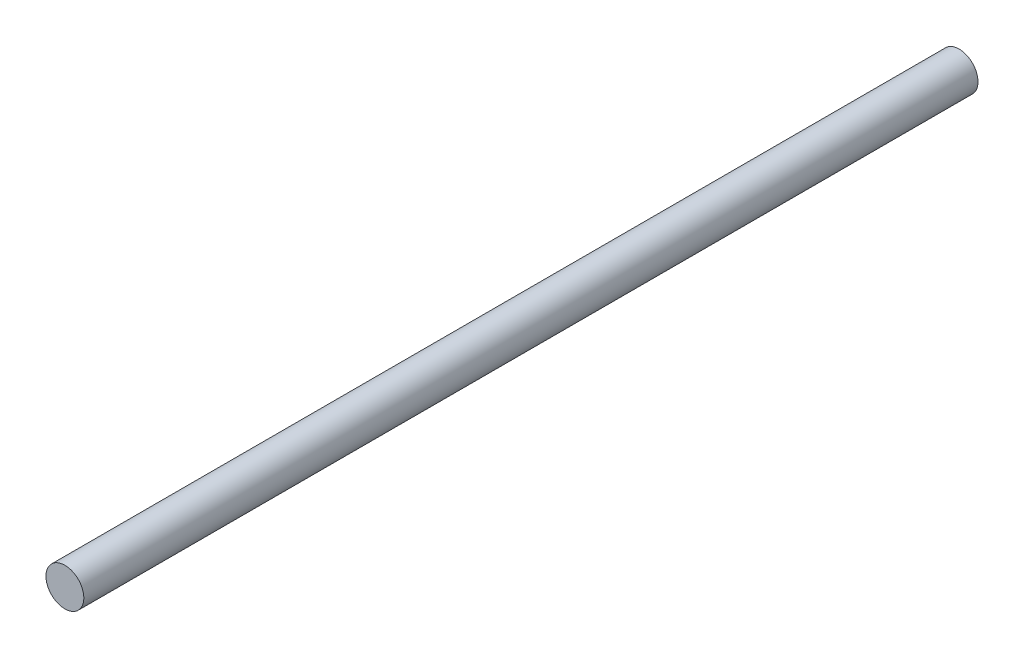
from build123d import *

# Parameters (mm, degrees)
SKETCH1_R           = 3.175
BOSS_EXTRUDE1_DEPTH = 150


with BuildPart() as part:
    # Sketch1 → Boss-Extrude1 (new body)
    with BuildSketch(Plane.XY):
        with Locations((0, 13.739794138)):
            Circle(SKETCH1_R)
    extrude(amount=BOSS_EXTRUDE1_DEPTH)


solid = part.part
